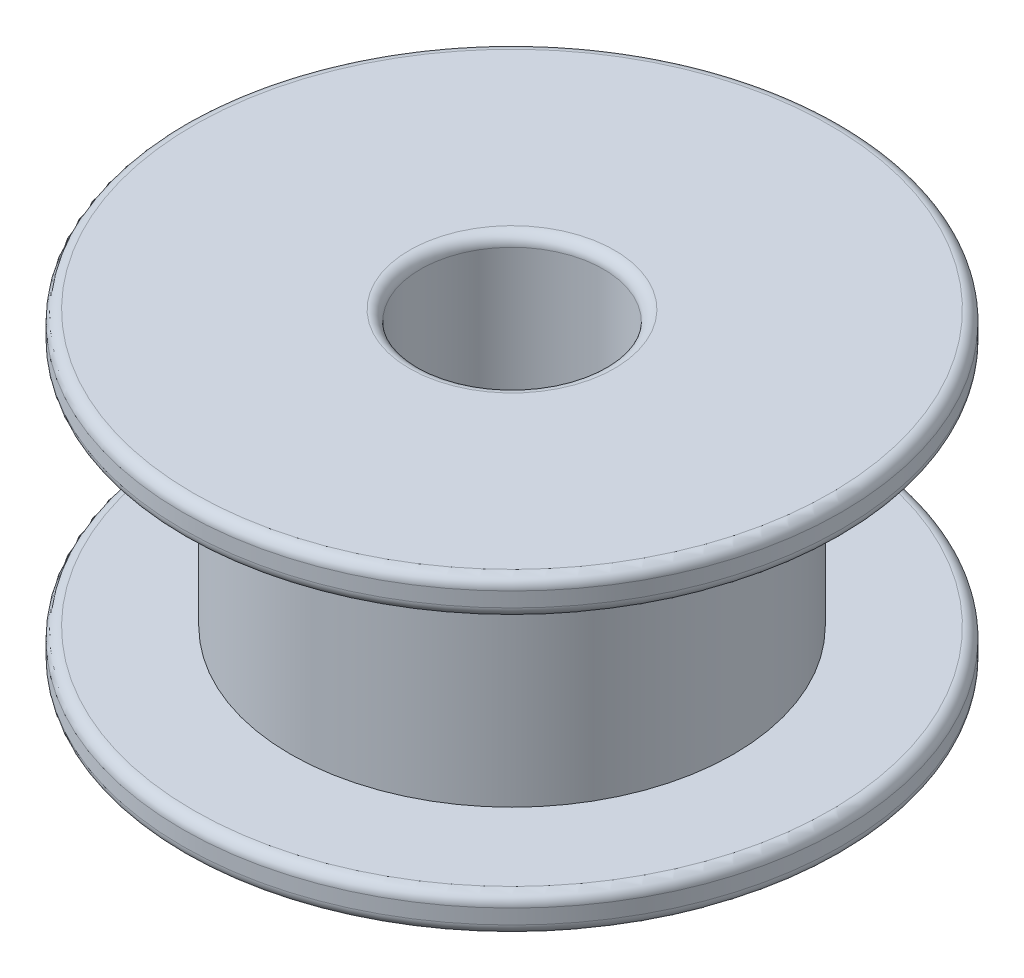
from build123d import *

# Parameters (mm, degrees)
SKETCH1_R           = 9
SKETCH1_R_2         = 2.5
BOSS_EXTRUDE1_DEPTH = 1
SKETCH2_R           = 6.05
SKETCH2_R_2         = 2.5
BOSS_EXTRUDE2_DEPTH = 6.5
SKETCH3_R           = 9
SKETCH3_R_2         = 2.5
BOSS_EXTRUDE3_DEPTH = 1
FILLET1_R           = 0.3


with BuildPart() as part:
    # Sketch1 → Boss-Extrude1 (new body)
    with BuildSketch(Plane(origin=(0, 0, 0), x_dir=(1, 0, 0), z_dir=(0, 1, 0))):
        with Locations(Location((0, 0, 0), (0, 0, 270))):
            Circle(SKETCH1_R)
        with Locations(Location((0, 0, 0), (0, 0, 270))):
            Circle(SKETCH1_R_2, mode=Mode.SUBTRACT)
    extrude(amount=BOSS_EXTRUDE1_DEPTH)

    # Sketch2 → Boss-Extrude2 (add)
    with BuildSketch(Plane(origin=(0, 1, 0), x_dir=(1, 0, 0), z_dir=(0, 1, 0))):
        with Locations(Location((0, 0, 0), (0, 0, 90))):
            Circle(SKETCH2_R)
        with Locations(Location((0, 0, 0), (0, 0, 270))):
            Circle(SKETCH2_R_2, mode=Mode.SUBTRACT)
    extrude(amount=BOSS_EXTRUDE2_DEPTH)

    # Sketch3 → Boss-Extrude3 (add)
    with BuildSketch(Plane(origin=(0, 7.5, 0), x_dir=(1, 0, 0), z_dir=(0, 1, 0))):
        with Locations(Location((0, 0, 0), (0, 0, 270))):
            Circle(SKETCH3_R)
        with Locations(Location((0, 0, 0), (0, 0, 270))):
            Circle(SKETCH3_R_2, mode=Mode.SUBTRACT)
    extrude(amount=BOSS_EXTRUDE3_DEPTH)

    # Fillet1
    fillet1_edges = [part.edges().sort_by_distance(p)[0] for p in [
        (0, 8.5, -9),
        (0, 7.5, -9),
        (0, 8.5, -2.5),
        (0, 0, -9),
        (0, 1, -9),
        (0, 0, -2.5),
    ]]
    fillet(fillet1_edges, radius=FILLET1_R)


solid = part.part
